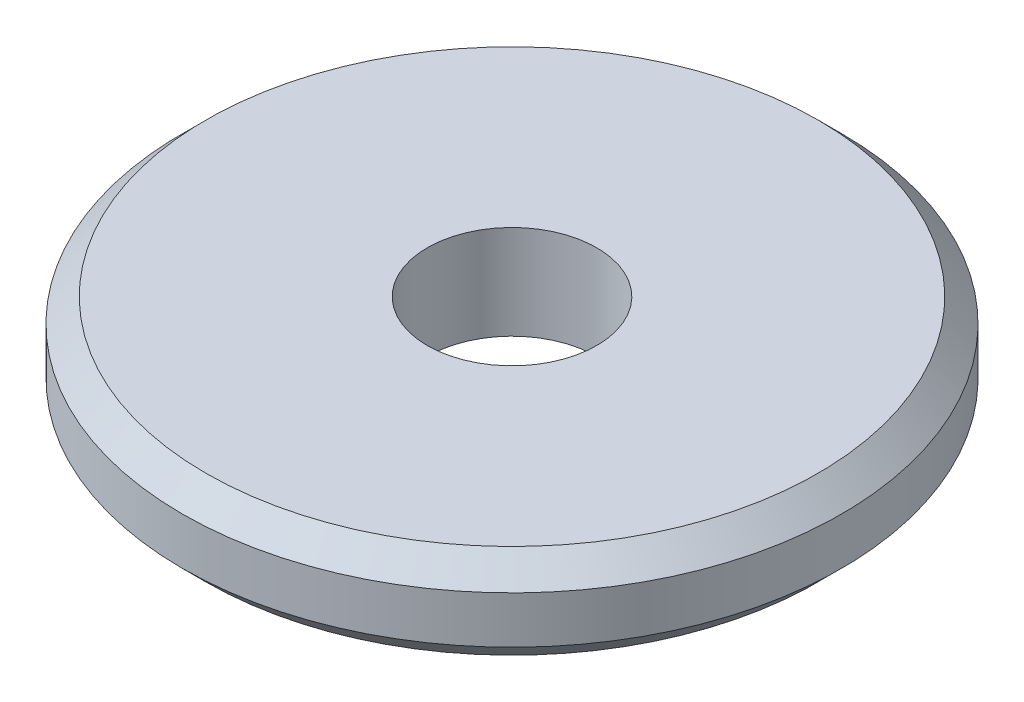
from build123d import *

# Parameters (mm, degrees)
SKETCH1_R           = 7
SKETCH1_R_2         = 1.8
BOSS_EXTRUDE1_DEPTH = 2
CHAMFER1_SIZE       = 0.5


with BuildPart() as part:
    # Sketch1 → Boss-Extrude1 (new body)
    with BuildSketch(Plane(origin=(0, 0, 0), x_dir=(1, 0, 0), z_dir=(0, 1, 0))):
        with Locations(Location((0, 0, 0), (0, 0, 270))):
            Circle(SKETCH1_R)
        with Locations(Location((0, 0, 0), (0, 0, 270))):
            Circle(SKETCH1_R_2, mode=Mode.SUBTRACT)
    extrude(amount=BOSS_EXTRUDE1_DEPTH)

    # Chamfer1
    chamfer1_edges = [part.edges().sort_by_distance(p)[0] for p in [
        (0, 0, -7),
        (0, 2, -7),
    ]]
    chamfer(chamfer1_edges, length=CHAMFER1_SIZE)


solid = part.part
